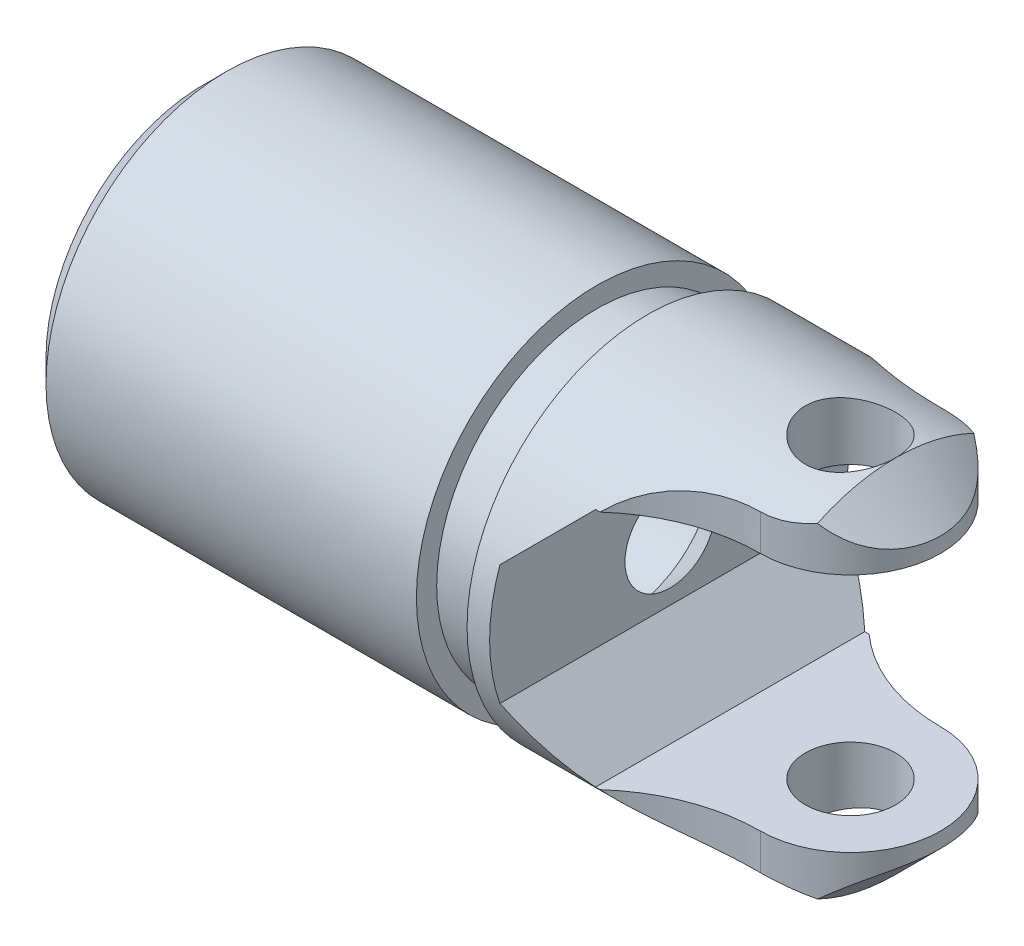
from build123d import *

# Parameters (mm, degrees)
CHAMFER1_SIZE       = 1.190625
CHAMFER2_SIZE       = 2.38125
EXTRUDE1_DEPTH      = 37.693234752
EXTRUDE1_DEPTH_BACK = 37.693234752
EXTRUDE3_DEPTH      = 37.693234804
EXTRUDE3_DEPTH_BACK = 37.693234804
SKETCH4_R           = 4.7625
EXTRUDE4_DEPTH      = 22.225
EXTRUDE6_DEPTH      = 37.693234804
EXTRUDE6_DEPTH_BACK = 37.693234804
SKETCH6_R           = 2.38125


with BuildPart() as part:
    # Sketch1 → Revolve1 (revolve)
    with BuildSketch(Plane(origin=(0, 0, 0), x_dir=(1, 0, 0), z_dir=(0, 1, 0)), mode=Mode.PRIVATE) as revolve1_sk:
        Polygon((-34.13125, 9.525), (-13.389570313, 9.525), (-13.389570313, 8.455421875), (-10.715625, 8.455421875), (-10.715625, 9.525), (4.7625, 9.525), (4.7625, 0), (-34.13125, 0), align=None)
    revolve(revolve1_sk.sketch.rotate(Axis((-34.13125, 0, 0), (1, 0, 0)), 180), axis=Axis((-34.13125, 0, 0), (1, 0, 0)))

    # Chamfer1
    chamfer1_edges = [part.edges().sort_by_distance(p)[0] for p in [
        (-34.13125, 0, -9.525),
    ]]
    chamfer(chamfer1_edges, length=CHAMFER1_SIZE)

    # Chamfer2
    chamfer2_edges = [part.edges().sort_by_distance(p)[0] for p in [
        (4.7625, 0, -9.525),
    ]]
    chamfer(chamfer2_edges, length=CHAMFER2_SIZE)

    # Sketch2 → Extrude1 (cut, two sides: drawn at the far end of the back side and taken through both)
    with BuildSketch(Plane(origin=(0, 0, 0), x_dir=(1, 0, 0), z_dir=(0, 1, 0)).offset(-EXTRUDE1_DEPTH_BACK)):
        with BuildLine():
            Line((-8.041679688, 9.525), (9.525, 9.525))
            Line((9.525, 9.525), (9.525, -9.525))
            Line((9.525, -9.525), (-8.041679688, -9.525))
            ThreePointArc((-8.041679688, -9.525), (-4.673061589, -6.042446408), (0, -4.7625))
            ThreePointArc((0, -4.7625), (4.7625, 0), (0, 4.7625))
            ThreePointArc((0, 4.7625), (-4.673061589, 6.042446408), (-8.041679688, 9.525))
        make_face()
    extrude(amount=EXTRUDE1_DEPTH + EXTRUDE1_DEPTH_BACK, mode=Mode.SUBTRACT)

    # Sketch3 → Extrude3 (cut, two sides: drawn at the far end of the back side and taken through both)
    with BuildSketch(Plane.XY.offset(-EXTRUDE3_DEPTH_BACK)):
        Polygon((-6.353175, 6.34365), (-9.525, 3.171825), (-9.525, -3.171825), (-6.353175, -6.34365), (9.525, -6.34365), (9.525, 6.34365), align=None)
    extrude(amount=EXTRUDE3_DEPTH + EXTRUDE3_DEPTH_BACK, mode=Mode.SUBTRACT)

    # Sketch4 → Extrude4 (cut)
    with BuildSketch(Plane.ZY.offset(34.13125)):
        Circle(SKETCH4_R)
    extrude(amount=-EXTRUDE4_DEPTH, mode=Mode.SUBTRACT)

    # Extrude5 cone 1 section (through the dimple's axis) → Extrude5 (revolve, cut)
    with BuildSketch(Plane(origin=(-11.90625, 0, 0), x_dir=(0, 0, 1), z_dir=(0, 1, 0))):
        Polygon((0, 0), (4.7625, 0), (0, 4.7625), align=None)
    revolve(axis=Axis((-11.90625, 0, 0), (1, 0, 0)), mode=Mode.SUBTRACT)

    # Sketch6 → Extrude6 (cut, two sides: drawn at the far end of the back side and taken through both)
    with BuildSketch(Plane(origin=(0, 0, 0), x_dir=(1, 0, 0), z_dir=(0, 1, 0)).offset(-EXTRUDE6_DEPTH_BACK)):
        with Locations(Location((0, 0, 0), (0, 0, 180))):
            Circle(SKETCH6_R)
    extrude(amount=EXTRUDE6_DEPTH + EXTRUDE6_DEPTH_BACK, mode=Mode.SUBTRACT)


solid = part.part
